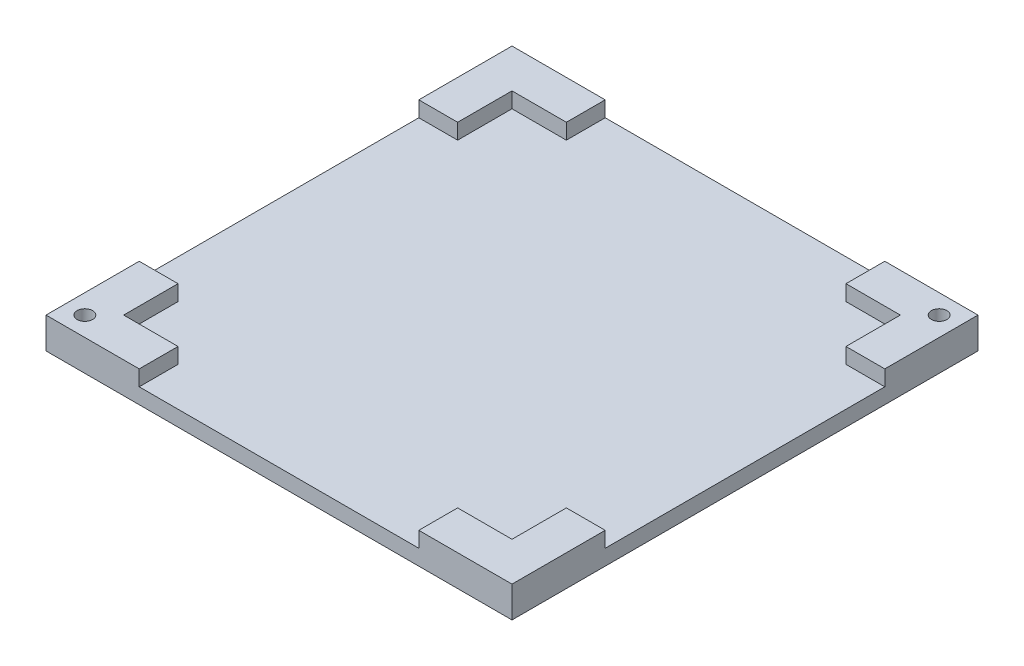
from build123d import *

# Parameters (mm, degrees)
SKETCH1_W           = 300
SKETCH1_H           = 300
BOSS_EXTRUDE1_DEPTH = 10
BOSS_EXTRUDE2_DEPTH = 10
SKETCH3_R           = 5
CUT_EXTRUDE1_DEPTH  = 15


with BuildPart() as part:
    # Sketch1 → Boss-Extrude1 (new body)
    with BuildSketch(Plane(origin=(0, 0, 0), x_dir=(1, 0, 0), z_dir=(0, 1, 0))):
        Rectangle(SKETCH1_W, SKETCH1_H)
    extrude(amount=BOSS_EXTRUDE1_DEPTH)

    # Sketch2 → Boss-Extrude2 (add)
    with BuildSketch(Plane(origin=(0, 10, 0), x_dir=(1, 0, 0), z_dir=(0, 1, 0))):
        Polygon((150, 150), (90, 150), (90, 125), (125, 125), (125, 90), (150, 90), align=None)
        Polygon((-150, 90), (-150, 150), (-90, 150), (-90, 125), (-125, 125), (-125, 90), align=None)
        Polygon((-150, -150), (-90, -150), (-90, -125), (-125, -125), (-125, -90), (-150, -90), align=None)
        Polygon((150, -90), (150, -150), (90, -150), (90, -125), (125, -125), (125, -90), align=None)
    extrude(amount=BOSS_EXTRUDE2_DEPTH)

    # Sketch3 → Cut-Extrude1 (cut)
    with BuildSketch(Plane(origin=(0, 20, 0), x_dir=(1, 0, 0), z_dir=(0, 1, 0))):
        with Locations(Location((-137.5, -137.5, 0), (0, 0, 270))):
            Circle(SKETCH3_R)
        with Locations(Location((137.5, 137.5, 0), (0, 0, 270))):
            Circle(SKETCH3_R)
    extrude(amount=-CUT_EXTRUDE1_DEPTH, mode=Mode.SUBTRACT)


solid = part.part
